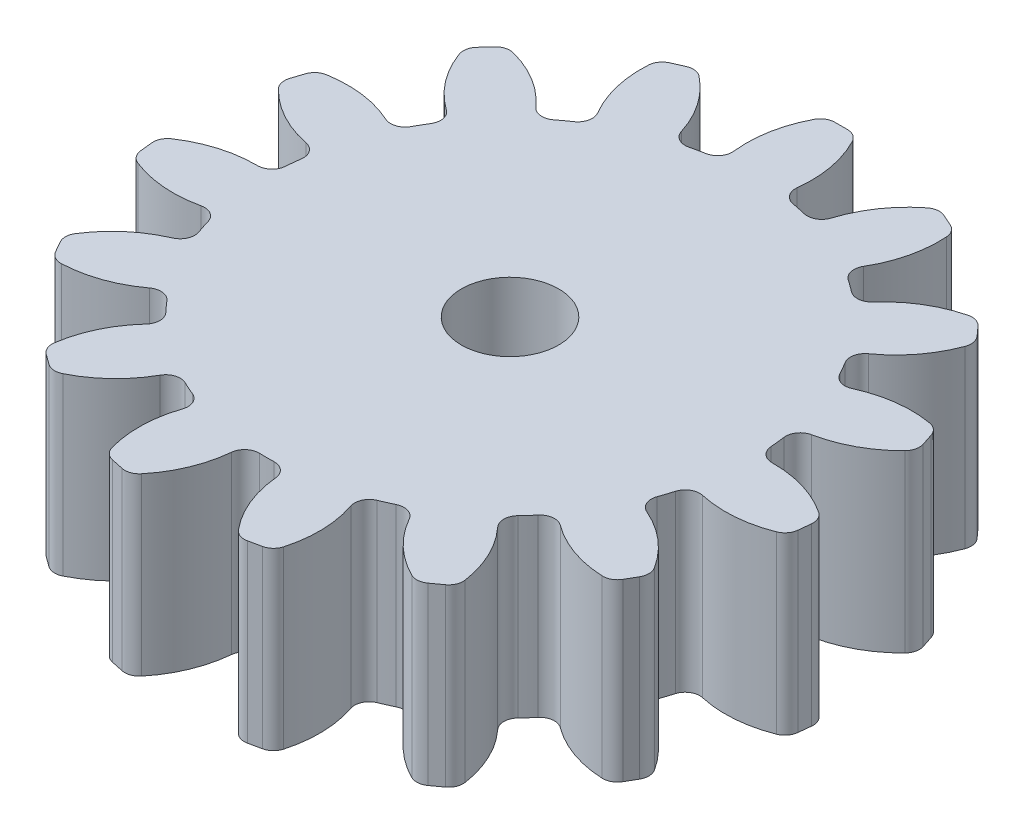
from build123d import *

# Parameters (mm, degrees)
SKETCH1_R           = 12.5
BOSS_EXTRUDE1_DEPTH = 9
BOSS_EXTRUDE2_DEPTH = 9
CIRPATTERN1_COUNT   = 15
SKETCH2_R           = 2.5
CUT_EXTRUDE1_DEPTH  = 10
FILLET1_R           = 0.75


with BuildPart() as part:
    # Sketch1 → Boss-Extrude1 (new body)
    with BuildSketch(Plane(origin=(0, 0, 0), x_dir=(1, 0, 0), z_dir=(0, 1, 0))):
        with Locations(Location((0, 0, 0), (0, 0, 270))):
            Circle(SKETCH1_R)
    extrude(amount=BOSS_EXTRUDE1_DEPTH)

    # Sketch1<3> → Boss-Extrude2 (add)
    with BuildSketch(Plane(origin=(0, 0, 0), x_dir=(1, 0, 0), z_dir=(0, 1, 0))):
        with BuildLine():
            Line((0.75, 17), (0, 17))
            Line((0, 17), (-0.75, 17))
            ThreePointArc((-0.75, 17), (-1.587894674, 14.78046783), (-1.5, 12.409673646))
            ThreePointArc((-1.5, 12.409673646), (0, 12.5), (1.5, 12.409673646))
            ThreePointArc((1.5, 12.409673646), (1.587894674, 14.78046783), (0.75, 17))
        make_face()
    boss_extrude2 = extrude(amount=BOSS_EXTRUDE2_DEPTH)

    # CirPattern1: Boss-Extrude2 ×15 about axis
    cirpattern1_axis = Axis((0, 0, 0), (0, 1, 0))
    for i in range(1, CIRPATTERN1_COUNT):
        add(boss_extrude2.rotate(cirpattern1_axis, i * 360 / CIRPATTERN1_COUNT))

    # Sketch2 → Cut-Extrude1 (cut)
    with BuildSketch(Plane(origin=(0, 9, 0), x_dir=(1, 0, 0), z_dir=(0, 1, 0))):
        with Locations(Location((0, 0, 0), (0, 0, 270))):
            Circle(SKETCH2_R)
    extrude(amount=-CUT_EXTRUDE1_DEPTH, mode=Mode.SUBTRACT)

    # Fillet1
    fillet1_edges = [part.edges().sort_by_distance(p)[0] for p in [
        (8.507748646, 4.5, 9.157958996),
        (9.99709263, 4.5, 7.503874929),
        (14.347431864, 4.5, 9.149519053),
        (15.097431864, 4.5, 7.850480947),
        (11.49709263, 4.5, 4.905798717),
        (12.18489946, 4.5, 2.788946959),
        (16.828475874, 4.5, 2.522875297),
        (16.985268569, 4.5, 1.031092454),
        (12.49848485, 4.5, -0.194618727),
        (12.265826478, 4.5, -2.408215277),
        (16.399723523, 4.5, -4.539996517),
        (15.936198031, 4.5, -5.966581292),
        (11.338775495, 4.5, -5.261384826),
        (10.225880665, 4.5, -7.188975213),
        (13.135309988, 4.5, -10.817861689),
        (12.131614078, 4.5, -11.932578927),
        (8.218488846, 4.5, -9.41840969),
        (6.417787187, 4.5, -10.726696026),
        (7.599682026, 4.5, -15.225220298),
        (6.229363839, 4.5, -15.835325262),
        (3.677150814, 4.5, -11.946905955),
        (-3.677150814, 4.5, -11.946905955),
        (-6.229363839, 4.5, -15.835325262),
        (-7.599682026, 4.5, -15.225220298),
        (-6.417787187, 4.5, -10.726696026),
        (-8.218488846, 4.5, -9.41840969),
        (-12.131614078, 4.5, -11.932578927),
        (-13.135309988, 4.5, -10.817861689),
        (-10.225880665, 4.5, -7.188975213),
        (-11.338775495, 4.5, -5.261384826),
        (-15.936198031, 4.5, -5.966581292),
        (-16.399723523, 4.5, -4.539996517),
        (-12.265826478, 4.5, -2.408215277),
        (-12.49848485, 4.5, -0.194618727),
        (-16.985268569, 4.5, 1.031092454),
        (-16.828475874, 4.5, 2.522875297),
        (-12.18489946, 4.5, 2.788946959),
        (-11.49709263, 4.5, 4.905798717),
        (-15.097431864, 4.5, 7.850480947),
        (-14.347431864, 4.5, 9.149519053),
        (-9.99709263, 4.5, 7.503874929),
        (-8.507748646, 4.5, 9.157958996),
        (-10.599112035, 4.5, 13.312449965),
        (-9.385586543, 4.5, 14.194127844),
        (-6.080697663, 4.5, 10.921314753),
        (1.5, 4.5, -12.409673646),
        (-4.047337631, 4.5, 11.826624966),
        (-4.268109444, 4.5, 16.472575444),
        (-2.800888043, 4.5, 16.784442981),
        (-1.112894829, 4.5, 12.450360039),
        (0.75, 4.5, -17),
        (1.112894829, 4.5, 12.450360039),
        (2.800888043, 4.5, 16.784442981),
        (4.268109444, 4.5, 16.472575444),
        (4.047337631, 4.5, 11.826624966),
        (-0.75, 4.5, -17),
        (-1.5, 4.5, -12.409673646),
        (6.080697663, 4.5, 10.921314753),
        (9.385586543, 4.5, 14.194127844),
        (10.599112035, 4.5, 13.312449965),
    ]]
    fillet(fillet1_edges, radius=FILLET1_R)


solid = part.part
